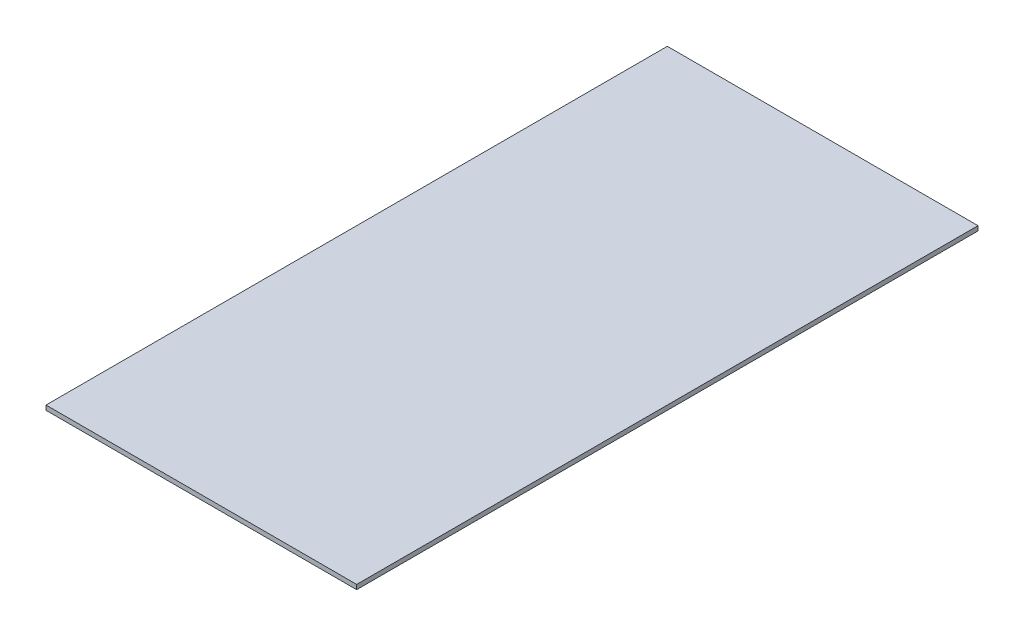
from build123d import *

# Parameters (mm, degrees)
SKETCH1_W           = 610
SKETCH1_H           = 1220
BOSS_EXTRUDE1_DEPTH = 9


with BuildPart() as part:
    # Sketch1 → Boss-Extrude1 (new body)
    with BuildSketch(Plane(origin=(0, 0, 0), x_dir=(1, 0, 0), z_dir=(0, 1, 0))):
        Rectangle(SKETCH1_W, SKETCH1_H)
    extrude(amount=BOSS_EXTRUDE1_DEPTH)


solid = part.part
